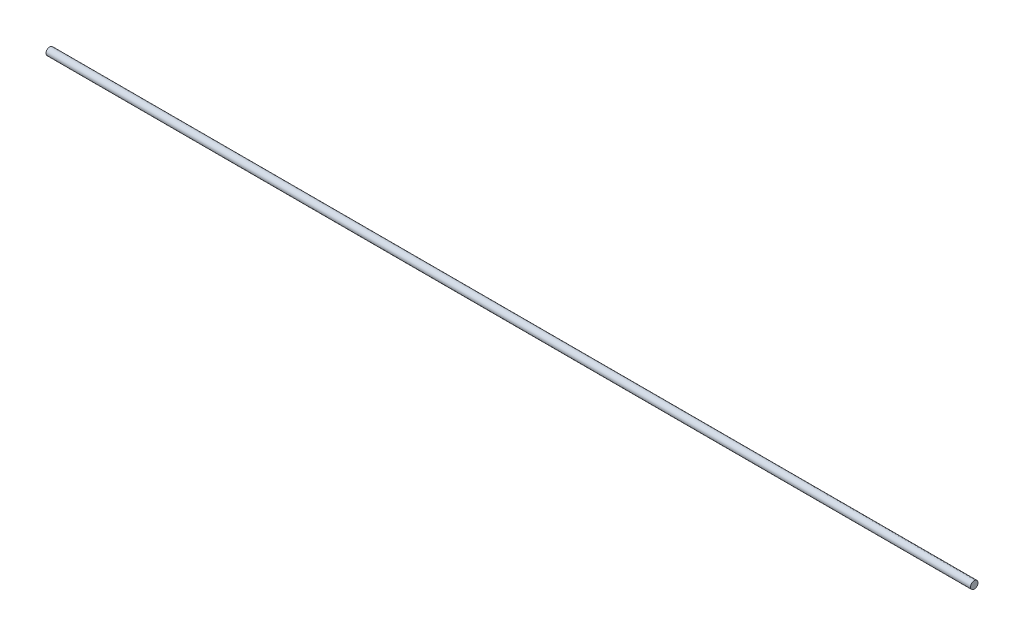
from build123d import *

# Parameters (mm, degrees)
SWEEP1_PROFILE_R = 4.7625


with BuildPart() as part:
    # Sweep1: sweep along a path in Sketch1
    with BuildLine(Plane(origin=(0, 0, 0), x_dir=(1, 0, 0), z_dir=(0, 1, 0))) as sweep1_path:
        Line((-590, 0), (590, 0))
    # Sweep1 profile (on start of the path) → Sweep1 (sweep)
    with BuildSketch(Plane(origin=(-590, 0, 0), x_dir=(0, 0, 1), z_dir=(1, 0, 0))):
        Circle(SWEEP1_PROFILE_R)
    sweep(path=sweep1_path.line)


solid = part.part
